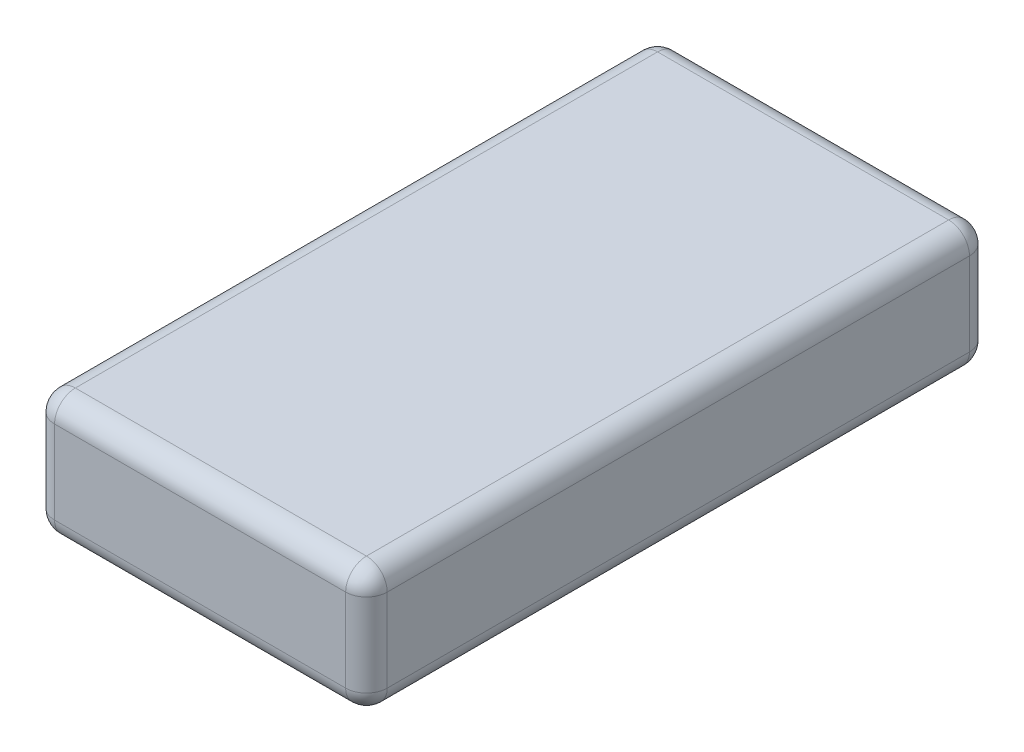
from build123d import *

# Parameters (mm, degrees)
SKETCH_1_W      = 32
SKETCH_1_H      = 60
EXTRUDE_1_DEPTH = 12
FILLET_1_R      = 2


with BuildPart() as part:
    # 草图1 → 凸台-拉伸1 (new body)
    with BuildSketch(Plane(origin=(0, 0, 0), x_dir=(1, 0, 0), z_dir=(0, 1, 0))):
        Rectangle(SKETCH_1_W, SKETCH_1_H)
    extrude(amount=EXTRUDE_1_DEPTH)

    # 圆角1
    fillet_1_edges = [part.edges().sort_by_distance(p)[0] for p in [
        (16, 12, 0),
        (0, 12, -30),
        (-16, 12, 0),
        (0, 0, -30),
        (16, 0, 0),
        (0, 0, 30),
        (-16, 0, 0),
        (-16, 6, -30),
        (16, 6, -30),
        (16, 6, 30),
        (-16, 6, 30),
        (0, 12, 30),
    ]]
    fillet(fillet_1_edges, radius=FILLET_1_R)


solid = part.part
